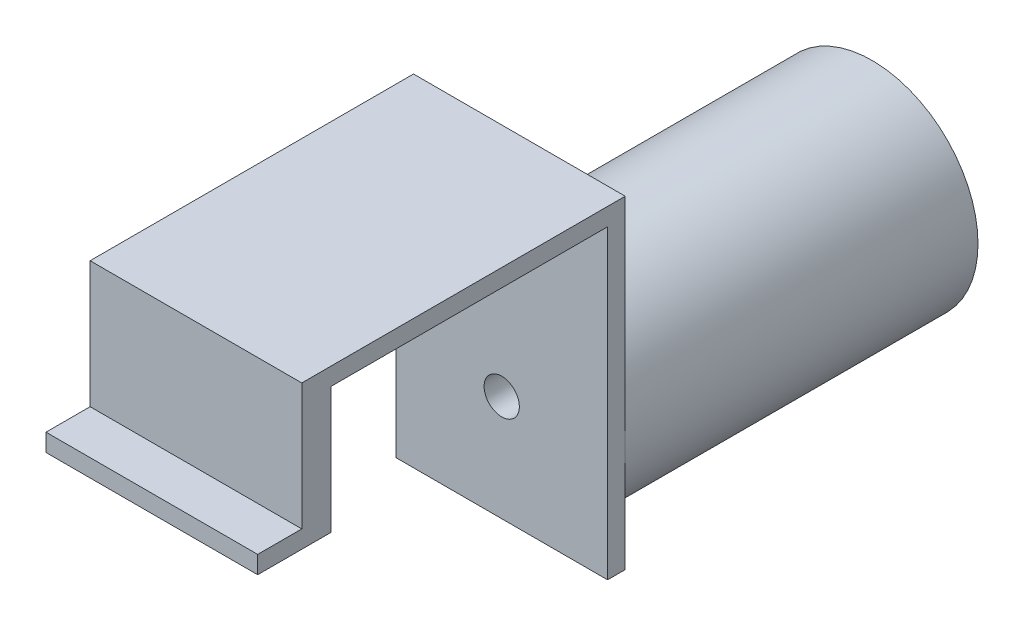
from build123d import *

# Parameters (mm, degrees)
SKETCH2_R               = 18
BOSS_EXTRUDE1_DEPTH     = 60
SKETCH4_W               = 36
SKETCH4_H               = 55
BOSS_EXTRUDE2_DEPTH     = 3
CUT_EXTRUDE1_DEPTH      = 3
CUT_EXTRUDE1_DEPTH_BACK = 60
SKETCH3_R               = 3
SKETCH6_W               = 36
SKETCH6_H               = 47
BOSS_EXTRUDE3_DEPTH     = 3
BOSS_EXTRUDE4_DEPTH     = 5
SKETCH8_W               = 36
SKETCH8_H               = 3
BOSS_EXTRUDE5_DEPTH     = 7.5


with BuildPart() as part:
    # Sketch2 → Boss-Extrude1 (new body)
    with BuildSketch(Plane.XY):
        Circle(SKETCH2_R)
    extrude(amount=BOSS_EXTRUDE1_DEPTH)

    # Sketch4 → Boss-Extrude2 (add)
    with BuildSketch(Plane.XY.offset(60)):
        with Locations((0, 9.5)):
            Rectangle(SKETCH4_W, SKETCH4_H)
    extrude(amount=BOSS_EXTRUDE2_DEPTH)

    # Sketch3 → Cut-Extrude1 (cut, two sides: drawn at the far end of the back side and taken through both)
    with BuildSketch(Plane.XY.offset(60).offset(-CUT_EXTRUDE1_DEPTH_BACK)):
        Circle(SKETCH3_R)
    extrude(amount=CUT_EXTRUDE1_DEPTH + CUT_EXTRUDE1_DEPTH_BACK, mode=Mode.SUBTRACT)

    # Sketch6 → Boss-Extrude3 (add)
    with BuildSketch(Plane(origin=(0, 37, 0), x_dir=(1, 0, 0), z_dir=(0, 1, 0))):
        with Locations((0, -86.5)):
            Rectangle(SKETCH6_W, SKETCH6_H)
    extrude(amount=-BOSS_EXTRUDE3_DEPTH)

    # Sketch7 → Boss-Extrude4 (add)
    with BuildSketch(Plane.XY.offset(110)):
        Polygon((18, 34), (18, 12.5), (-18, 12.5), (-18, 34), (-18, 37), (18, 37), align=None)
    extrude(amount=BOSS_EXTRUDE4_DEPTH)

    # Sketch8 → Boss-Extrude5 (add)
    with BuildSketch(Plane.XY.offset(115)):
        with Locations((0, 14)):
            Rectangle(SKETCH8_W, SKETCH8_H)
    extrude(amount=BOSS_EXTRUDE5_DEPTH)


solid = part.part
